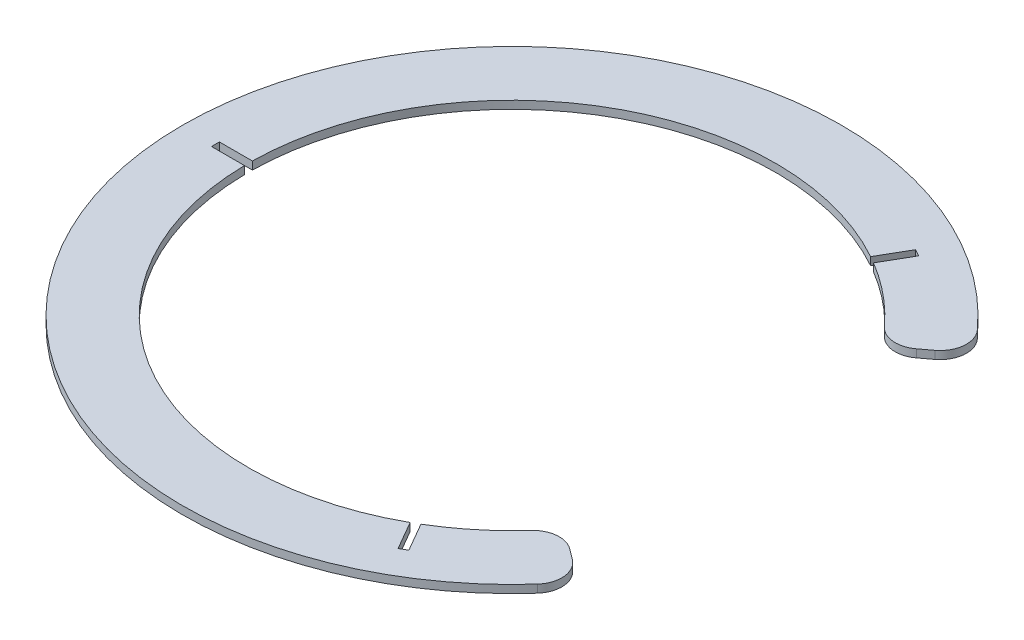
from build123d import *

# Parameters (mm, degrees)
SKETCH1_R           = 125
BOSS_EXTRUDE1_DEPTH = 3
SKETCH2_R           = 100
CUT_EXTRUDE1_DEPTH  = 3
SKETCH3_W           = 25
SKETCH3_H           = 3
CUT_EXTRUDE2_DEPTH  = 3
CIRPATTERN1_COUNT   = 3
CUT_EXTRUDE3_DEPTH  = 3
FILLET1_R           = 10


with BuildPart() as part:
    # Sketch1 → Boss-Extrude1 (new body)
    with BuildSketch(Plane(origin=(0, 0, 0), x_dir=(1, 0, 0), z_dir=(0, 1, 0))):
        with Locations(Location((0, 0, 0), (0, 0, 270))):
            Circle(SKETCH1_R)
    extrude(amount=BOSS_EXTRUDE1_DEPTH)

    # Sketch2 → Cut-Extrude1 (cut)
    with BuildSketch(Plane(origin=(0, 3, 0), x_dir=(1, 0, 0), z_dir=(0, 1, 0))):
        with Locations(Location((0, 0, 0), (0, 0, 270))):
            Circle(SKETCH2_R)
    extrude(amount=-CUT_EXTRUDE1_DEPTH, mode=Mode.SUBTRACT)

    # Sketch3 → Cut-Extrude2 (cut)
    with BuildSketch(Plane(origin=(0, 3, 0), x_dir=(1, 0, 0), z_dir=(0, 1, 0))):
        with Locations((-100, 0)):
            Rectangle(SKETCH3_W, SKETCH3_H)
    cut_extrude2 = extrude(amount=-CUT_EXTRUDE2_DEPTH, mode=Mode.SUBTRACT)

    # CirPattern1: Cut-Extrude2 ×3 about axis
    cirpattern1_axis = Axis((0, 0, 0), (0, 1, 0))
    for i in range(1, CIRPATTERN1_COUNT):
        add(cut_extrude2.rotate(cirpattern1_axis, i * 360 / CIRPATTERN1_COUNT), mode=Mode.SUBTRACT)

    # Sketch4 → Cut-Extrude3 (cut)
    with BuildSketch(Plane(origin=(0, 3, 0), x_dir=(1, 0, 0), z_dir=(0, 1, 0))):
        with BuildLine():
            Line((80, -60), (99.982550279, -75.023260657))
            ThreePointArc((99.982550279, -75.023260657), (124.999999154, -0.014539179), (100, 75))
            Line((100, 75), (80, 60))
            ThreePointArc((80, 60), (100, 0), (80, -60))
        make_face()
    extrude(amount=-CUT_EXTRUDE3_DEPTH, mode=Mode.SUBTRACT)

    # Fillet1
    fillet1_edges = [part.edges().sort_by_distance(p)[0] for p in [
        (80, 1.5, 60),
        (80, 1.5, -60),
        (100, 1.5, -75),
        (99.982550279, 1.5, 75.023260657),
    ]]
    fillet(fillet1_edges, radius=FILLET1_R)


solid = part.part
